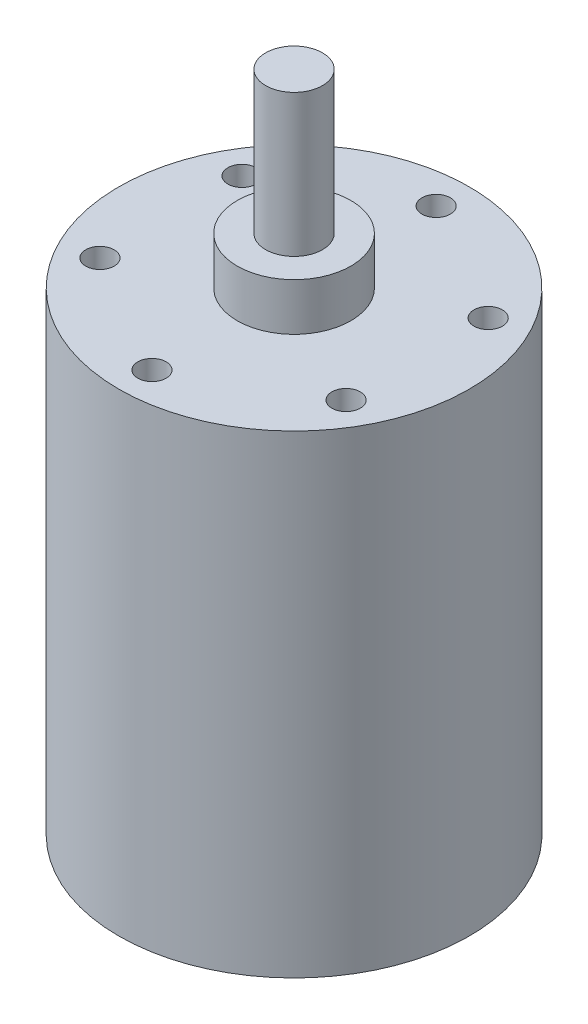
from build123d import *

# Parameters (mm, degrees)
SKETCH1_R           = 18.5
BOSS_EXTRUDE1_DEPTH = 50
SKETCH2_R           = 6
BOSS_EXTRUDE2_DEPTH = 5
SKETCH3_R           = 3
BOSS_EXTRUDE3_DEPTH = 15
SKETCH4_R           = 1.5
CUT_EXTRUDE1_DEPTH  = 10


with BuildPart() as part:
    # Sketch1 → Boss-Extrude1 (new body)
    with BuildSketch(Plane(origin=(0, 0, 0), x_dir=(1, 0, 0), z_dir=(0, 1, 0))):
        with Locations(Location((0, 0, 0), (0, 0, 270))):
            Circle(SKETCH1_R)
    extrude(amount=BOSS_EXTRUDE1_DEPTH)

    # Sketch2 → Boss-Extrude2 (add)
    with BuildSketch(Plane(origin=(0, 50, 0), x_dir=(1, 0, 0), z_dir=(0, 1, 0))):
        with Locations(Location((0, 0, 0), (0, 0, 270))):
            Circle(SKETCH2_R)
    extrude(amount=BOSS_EXTRUDE2_DEPTH)

    # Sketch3 → Boss-Extrude3 (add)
    with BuildSketch(Plane(origin=(0, 55, 0), x_dir=(1, 0, 0), z_dir=(0, 1, 0))):
        with Locations(Location((0, 0, 0), (0, 0, 270))):
            Circle(SKETCH3_R)
    extrude(amount=BOSS_EXTRUDE3_DEPTH)

    # Sketch4 → Cut-Extrude1 (cut)
    with BuildSketch(Plane(origin=(0, 50, 0), x_dir=(1, 0, 0), z_dir=(0, 1, 0))):
        with Locations(Location((0, 15, 0), (0, 0, 270))):
            Circle(SKETCH4_R)
        with Locations(Location((12.990381057, 7.5, 0), (0, 0, 270))):
            Circle(SKETCH4_R)
        with Locations(Location((12.990381057, -7.5, 0), (0, 0, 270))):
            Circle(SKETCH4_R)
        with Locations(Location((0, -15, 0), (0, 0, 270))):
            Circle(SKETCH4_R)
        with Locations(Location((-12.990381057, -7.5, 0), (0, 0, 270))):
            Circle(SKETCH4_R)
        with Locations(Location((-12.990381057, 7.5, 0), (0, 0, 270))):
            Circle(SKETCH4_R)
    extrude(amount=-CUT_EXTRUDE1_DEPTH, mode=Mode.SUBTRACT)


solid = part.part
